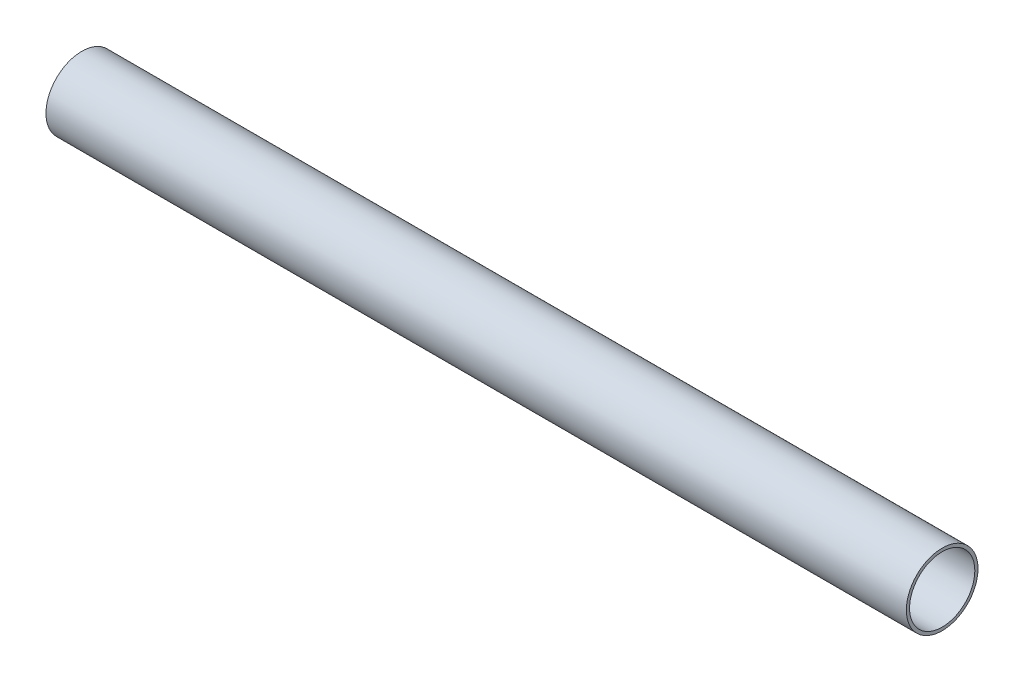
from build123d import *

# Parameters (mm, degrees)
SKETCH1_R           = 5.715
SKETCH1_R_2         = 5.207
BOSS_EXTRUDE1_DEPTH = 137.249916


with BuildPart() as part:
    # Sketch1 → Boss-Extrude1 (new body)
    with BuildSketch(Plane.YZ):
        Circle(SKETCH1_R)
        Circle(SKETCH1_R_2, mode=Mode.SUBTRACT)
    extrude(amount=BOSS_EXTRUDE1_DEPTH)


solid = part.part
